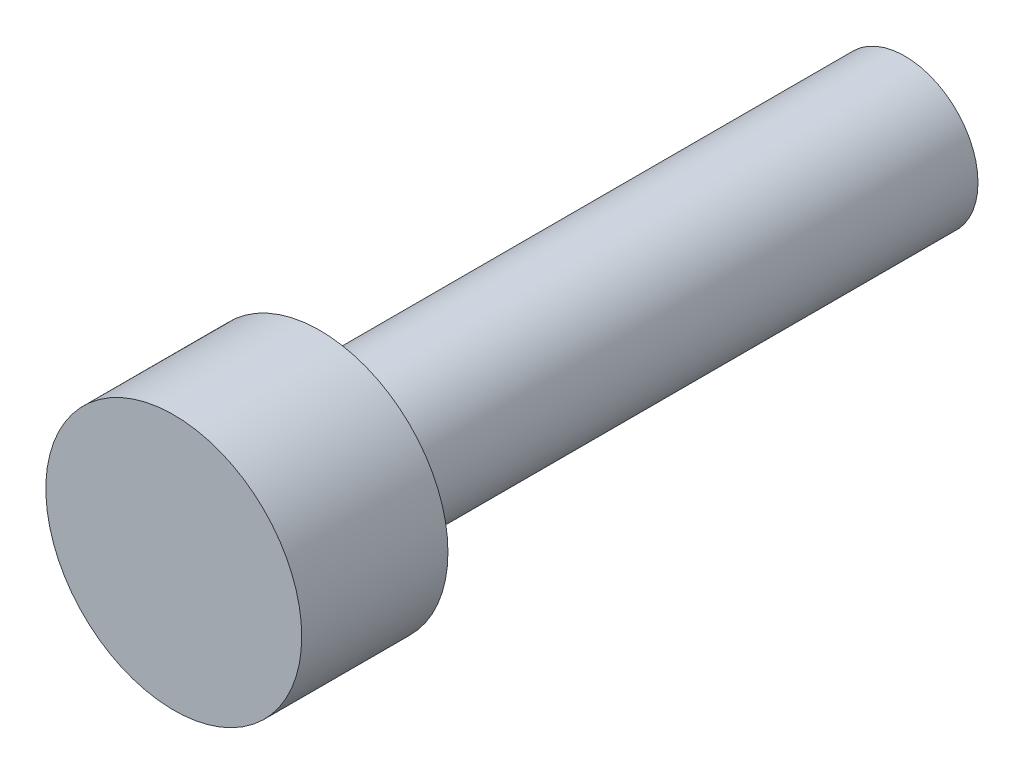
from build123d import *

# Parameters (mm, degrees)
NOMINAL_SHANK_START    = -16
SKETCH_NOMINAL_SHANK_R = 2
NOMINAL_SHANK_DEPTH    = 16
SKETCH_HEAD_R          = 3.5
HEAD_DEPTH             = 4


with BuildPart() as part:
    # Sketch_Nominal_shank → Nominal_shank (new body)
    with BuildSketch(Plane.XY.offset(NOMINAL_SHANK_START)):
        Circle(SKETCH_NOMINAL_SHANK_R)
    extrude(amount=NOMINAL_SHANK_DEPTH)

    # Sketch_Head → Head (add)
    with BuildSketch(Plane.XY):
        Circle(SKETCH_HEAD_R)
    extrude(amount=HEAD_DEPTH)


solid = part.part
